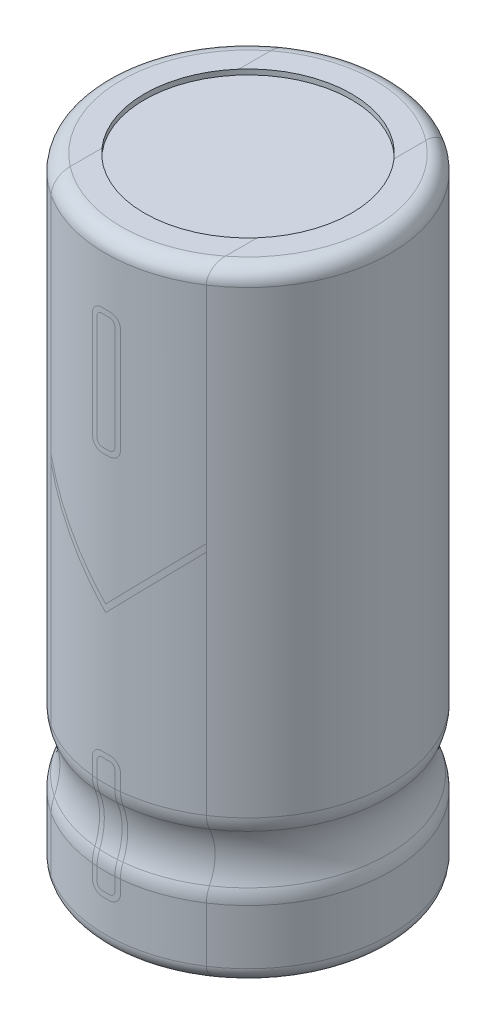
from build123d import *

# Parameters (mm, degrees)
SKETCH1_R           = 2.75
BOSS_EXTRUDE1_DEPTH = 12
FILLET2_R           = 0.3
FILLET3_R           = 0.3
FILLET4_R           = 0.7
SKETCH3_R           = 2
CUT_EXTRUDE1_DEPTH  = 0.1
CUT_EXTRUDE3_START  = -0.1
SKETCH5_R           = 2
CUT_EXTRUDE3_DEPTH  = 0.1


with BuildPart() as part:
    # Sketch1 → Boss-Extrude1 (new body)
    with BuildSketch(Plane(origin=(0, 0, 0), x_dir=(1, 0, 0), z_dir=(0, 1, 0))):
        Circle(SKETCH1_R)
    extrude(amount=BOSS_EXTRUDE1_DEPTH)

    # Sketch2 → Cut-Revolve1 (revolve, cut)
    with BuildSketch(Plane.XY):
        with BuildLine():
            Line((2.75, 2.67418437), (2.75, 1.507628734))
            ThreePointArc((2.75, 1.507628734), (2.609122054, 2.090906552), (2.75, 2.67418437))
        make_face()
    revolve(axis=Axis((0, 0, 0), (0, 1, 0)), mode=Mode.SUBTRACT)

    # Fillet2
    fillet2_edges = [part.edges().sort_by_distance(p)[0] for p in [
        (-2.75, 12, 0),
    ]]
    fillet(fillet2_edges, radius=FILLET2_R)

    # Fillet3
    fillet3_edges = [part.edges().sort_by_distance(p)[0] for p in [
        (-2.75, 0, 0),
    ]]
    fillet(fillet3_edges, radius=FILLET3_R)

    # Fillet4
    fillet4_edges = [part.edges().sort_by_distance(p)[0] for p in [
        (-2.75, 1.507628734, 0),
        (-2.75, 2.67418437, 0),
    ]]
    fillet(fillet4_edges, radius=FILLET4_R)

    # Sketch3 → Cut-Extrude1 (cut)
    with BuildSketch(Plane(origin=(0, 12, 0), x_dir=(1, 0, 0), z_dir=(0, 1, 0))):
        Circle(SKETCH3_R)
    extrude(amount=-CUT_EXTRUDE1_DEPTH, mode=Mode.SUBTRACT)

    # Sketch5 → Cut-Extrude3 (cut)
    with BuildSketch(Plane.XZ.offset(CUT_EXTRUDE3_START)):
        Circle(SKETCH5_R)
    extrude(amount=CUT_EXTRUDE3_DEPTH, mode=Mode.SUBTRACT)


solid = part.part
